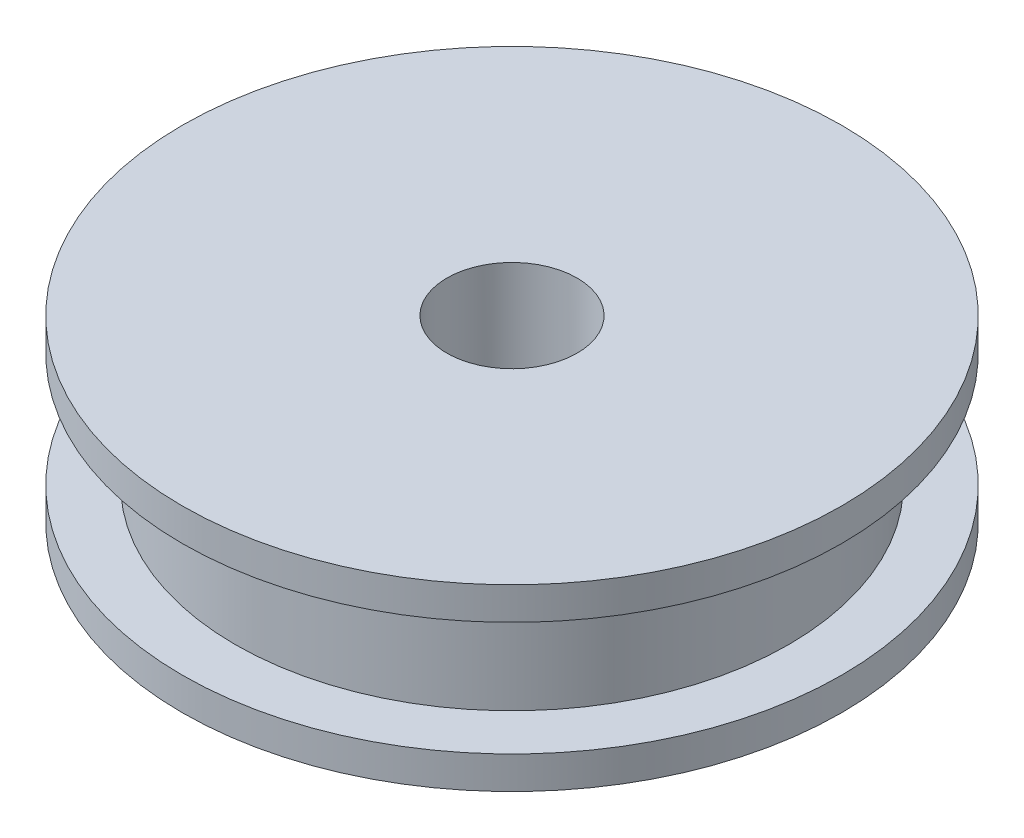
from build123d import *

# Parameters (mm, degrees)
SKETCH2_R          = 2
CUT_EXTRUDE1_DEPTH = 34.824916851
CIRPATTERN1_COUNT  = 2
CIRPATTERN1_ANGLE  = 90


with BuildPart() as part:
    # Sketch1 → Revolve1 (revolve)
    with BuildSketch(Plane.XY, mode=Mode.PRIVATE) as revolve1_sk:
        Polygon((-4, 0), (-4, 18), (-20.25, 18), (-20.25, 16), (-17, 16), (-17, 9), (-20.25, 9), (-20.25, 7), (-10, 7), (-10, 0), align=None)
    revolve(revolve1_sk.sketch.rotate(Axis((0, 0, 0), (0, 1, 0)), 270), axis=Axis((0, 0, 0), (0, 1, 0)))

    # Sketch2 → Cut-Extrude1 (cut, through all)
    with BuildSketch(Plane.XY):
        with Locations(Location((0, 3.5, 0), (0, 0, 90))):
            Circle(SKETCH2_R)
    cut_extrude1 = extrude(amount=-CUT_EXTRUDE1_DEPTH, mode=Mode.SUBTRACT)

    # CirPattern1: Cut-Extrude1 ×2 about axis
    cirpattern1_axis = Axis((0, 0, 0), (0, 1, 0))
    for i in range(1, CIRPATTERN1_COUNT):
        add(cut_extrude1.rotate(cirpattern1_axis, i * CIRPATTERN1_ANGLE / (CIRPATTERN1_COUNT - 1)), mode=Mode.SUBTRACT)


solid = part.part
